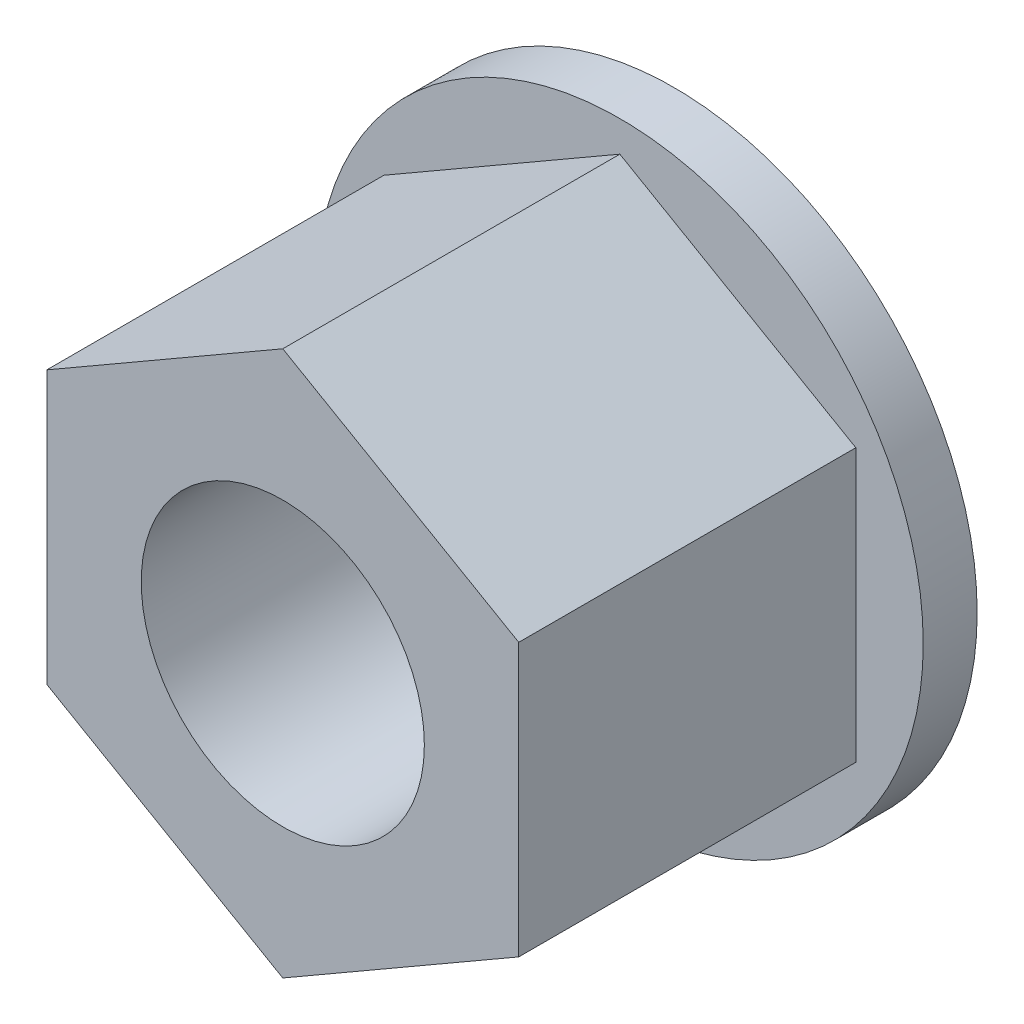
from build123d import *

# Parameters (mm, degrees)
M4_WASHER_ENVELOPE_PROFILE_R        = 4.5
M4_WASHER_ENVELOPE_PROFILE_R_2      = 2.1
M4_WASHER_ENVELOPE_DEPTH            = 0.8
M4_START                            = 0.8
M4_LOCKNUT_OUTER_ENVELOPE_PROFILE_R = 2.1
M4_LOCKNUT_OUTER_ENVELOPE_DEPTH     = 5


with BuildPart() as part:
    # M4 washer envelope profile → M4 washer envelope (new body)
    with BuildSketch(Plane.XY):
        Circle(M4_WASHER_ENVELOPE_PROFILE_R)
        Circle(M4_WASHER_ENVELOPE_PROFILE_R_2, mode=Mode.SUBTRACT)
    extrude(amount=M4_WASHER_ENVELOPE_DEPTH)

    # M4 locknut outer envelope profile → M4 locknut outer envelope (add)
    with BuildSketch(Plane.XY.offset(M4_START)):
        Polygon((3.5, 2.020725942), (0, 4.041451884), (-3.5, 2.020725942), (-3.5, -2.020725942), (0, -4.041451884), (3.5, -2.020725942), align=None)
        Circle(M4_LOCKNUT_OUTER_ENVELOPE_PROFILE_R, mode=Mode.SUBTRACT)
    extrude(amount=M4_LOCKNUT_OUTER_ENVELOPE_DEPTH)


solid = part.part
